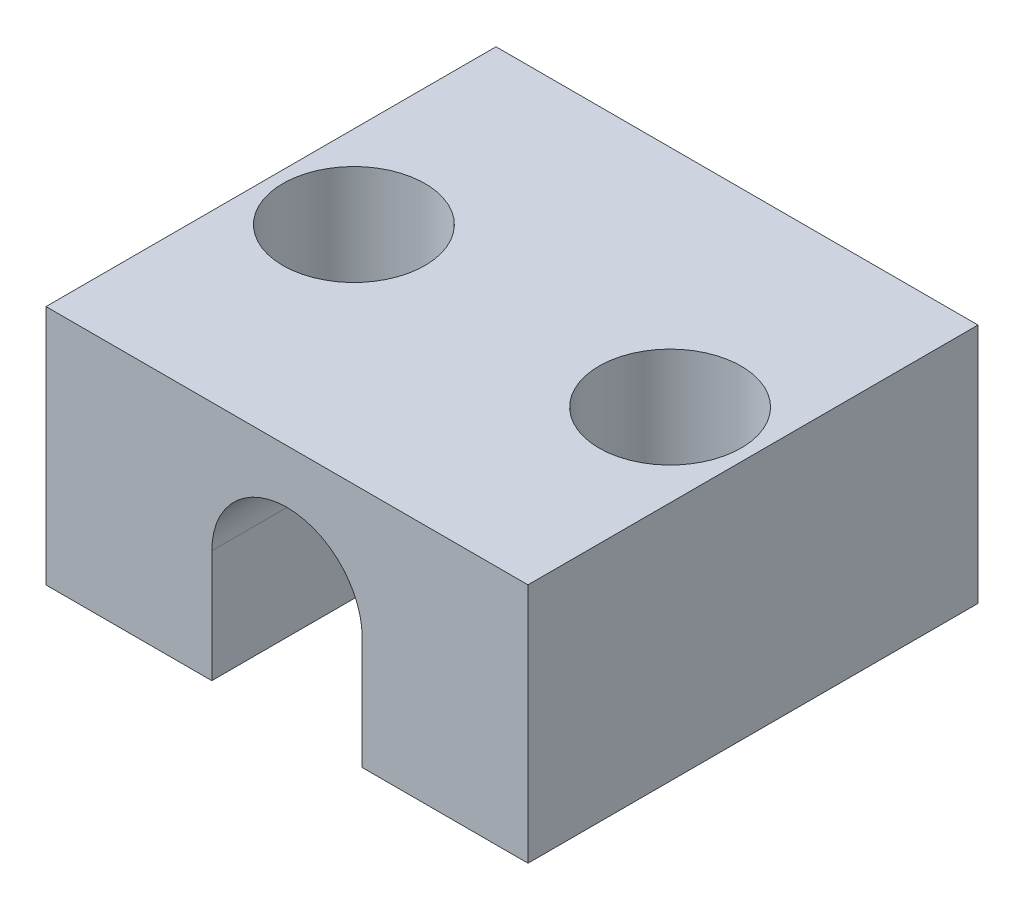
from build123d import *

# Parameters (mm, degrees)
BOSS_EXTRUDE1_DEPTH = 19
SKETCH2_R           = 1.8
CUT_EXTRUDE1_DEPTH  = 24.836170519
SKETCH2_3_R         = 3
SKETCH2_3_R_2       = 1.8
CUT_EXTRUDE2_DEPTH  = 7.18


with BuildPart() as part:
    # Sketch1 → Boss-Extrude1 (new body)
    with BuildSketch(Plane.XY):
        with BuildLine():
            Line((-10.175, 0), (-10.175, 10.18))
            Line((-10.175, 10.18), (10.175, 10.18))
            Line((10.175, 10.18), (10.175, 0))
            Line((10.175, 0), (3.175, 0))
            Line((3.175, 0), (3.175, 4.75))
            ThreePointArc((3.175, 4.75), (0, 7.925), (-3.175, 4.75))
            Line((-3.175, 4.75), (-3.175, 0))
            Line((-3.175, 0), (-10.175, 0))
        make_face()
    extrude(amount=BOSS_EXTRUDE1_DEPTH)

    # Sketch2 → Cut-Extrude1 (cut, through all)
    with BuildSketch(Plane(origin=(0, 10.18, 0), x_dir=(1, 0, 0), z_dir=(0, 1, 0))):
        with Locations(Location((-6.675, -9.5, 0), (0, 0, 270))):
            Circle(SKETCH2_R)
        with Locations(Location((6.675, -9.5, 0), (0, 0, 270))):
            Circle(SKETCH2_R)
    extrude(amount=-CUT_EXTRUDE1_DEPTH, mode=Mode.SUBTRACT)

    # Sketch2<3> → Cut-Extrude2 (cut)
    # profile 1 of 2: a face of its own
    with BuildSketch(Plane(origin=(0, 10.18, 0), x_dir=(1, 0, 0), z_dir=(0, 1, 0))):
        with Locations(Location((-6.675, -9.5, 0), (0, 0, 270))):
            Circle(SKETCH2_3_R)
        with Locations(Location((-6.675, -9.5, 0), (0, 0, 270))):
            Circle(SKETCH2_3_R_2, mode=Mode.SUBTRACT)
    # profile 2 of 2: a face of its own
    with BuildSketch(Plane(origin=(0, 10.18, 0), x_dir=(1, 0, 0), z_dir=(0, 1, 0))):
        with Locations(Location((6.675, -9.5, 0), (0, 0, 270))):
            Circle(SKETCH2_3_R)
    extrude(amount=-CUT_EXTRUDE2_DEPTH, mode=Mode.SUBTRACT)


solid = part.part
